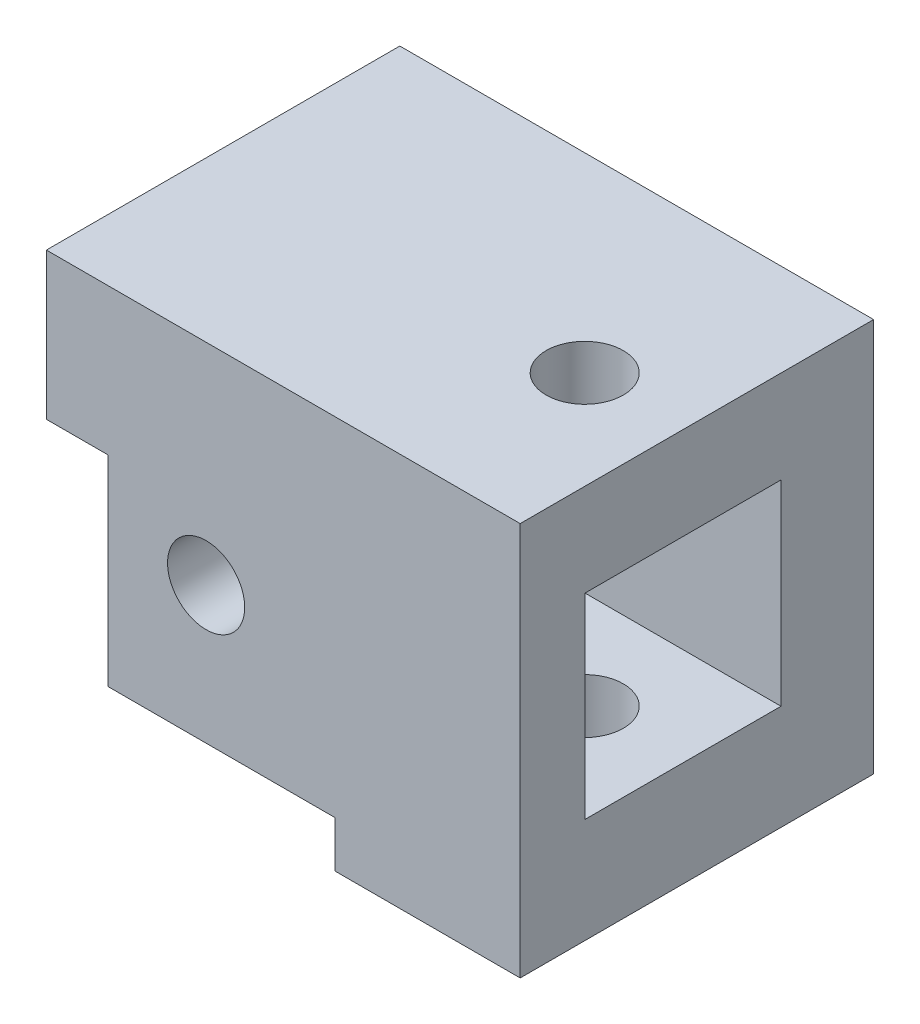
from build123d import *

# Parameters (mm, degrees)
SKETCH1_W               = 16.9
SKETCH1_H               = 24
BOSS_EXTRUDE1_DEPTH     = 17
SKETCH2_W               = 12.7
SKETCH2_H               = 12.7
CUT_EXTRUDE1_DEPTH      = 23.458906919
SKETCH3_R               = 2.5
CUT_EXTRUDE2_DEPTH      = 31.600694437
BOSS_EXTRUDE2_DEPTH     = 12.7
EXTRUDE_3_DEPTH         = 4
EXTRUDE_4_DEPTH         = 4
SKETCH5_R               = 2.5
CUT_EXTRUDE3_DEPTH      = 30.49254143
SKETCH_4_W              = 3
SKETCH_4_H              = 16.9
CUT_EXTRUDE_1_DEPTH     = 32.937477984
SKETCH_5_W              = 12.7
SKETCH_5_H              = 1.5
CUT_EXTRUDE_2_DEPTH     = 30.320641194
CUT_EXTRUDE4_DEPTH      = 25.039394751
CUT_EXTRUDE4_DEPTH_BACK = 2
SKETCH_6_W              = 4
SKETCH_6_H              = 24
CUT_EXTRUDE_3_DEPTH     = 25.039394751
SKETCH_7_W              = 20.9
SKETCH_7_H              = 1.5
CUT_EXTRUDE_4_DEPTH     = 26.469442475
SKETCH_8_W              = 4
SKETCH_8_H              = 22.5
CUT_EXTRUDE_5_DEPTH     = 36.234819426
SKETCH_9_W              = 4
SKETCH_9_H              = 17
CUT_EXTRUDE_6_DEPTH     = 27.617663308
SKETCH_11_W             = 12.7
SKETCH_11_H             = 3.8
EXTRUDE_5_DEPTH         = 2
SKETCH_12_W             = 6
SKETCH_12_H             = 22.5
EXTRUDE_6_DEPTH         = 26.7
SKETCH_21_W             = 22.9
SKETCH_21_H             = 9.5
EXTRUDE_7_DEPTH         = 4
SKETCH_14_R             = 2.5
CUT_EXTRUDE_7_DEPTH     = 31.778239066
SKETCH_22_W             = 12
SKETCH_22_H             = 22.9
SKETCH_22_R             = 2.5
EXTRUDE_8_DEPTH         = 3


with BuildPart() as part:
    # Sketch1 → Boss-Extrude1 (new body)
    with BuildSketch(Plane(origin=(0, 0, 0), x_dir=(0, 0, -1), z_dir=(1, 0, 0))):
        Rectangle(SKETCH1_W, SKETCH1_H)
    extrude(amount=BOSS_EXTRUDE1_DEPTH)

    # Sketch2 → Cut-Extrude1 (cut, through all)
    with BuildSketch(Plane(origin=(17, 0, 0), x_dir=(0, 0, -1), z_dir=(1, 0, 0))):
        with Locations((2.1, -0.35)):
            Rectangle(SKETCH2_W, SKETCH2_H)
    extrude(amount=-CUT_EXTRUDE1_DEPTH, mode=Mode.SUBTRACT)

    # Sketch3 → Cut-Extrude2 (cut, through all)
    with BuildSketch(Plane(origin=(0, 12, 0), x_dir=(1, 0, 0), z_dir=(0, 1, 0))):
        with Locations(Location((7.63, 2.1, 0), (0, 0, 270))):
            Circle(SKETCH3_R)
    extrude(amount=-CUT_EXTRUDE2_DEPTH, mode=Mode.SUBTRACT)

    # Sketch4 → Boss-Extrude2 (add)
    with BuildSketch(Plane.ZY):
        Polygon((-8.45, 12), (-8.45, 6), (4.25, 6), (4.25, -12), (8.45, -12), (8.45, 12), align=None)
    extrude(amount=BOSS_EXTRUDE2_DEPTH)

    # 草图3 → 凸台-拉伸3 (add)
    with BuildSketch(Plane.ZY.offset(12.7)):
        Polygon((8.45, 12), (-7.55, 12), (8.45, -5), align=None)
    extrude(amount=EXTRUDE_3_DEPTH)

    # 草图1 → 凸台-拉伸4 (add)
    with BuildSketch(Plane(origin=(0, 0, -8.45), x_dir=(-1, 0, 0), z_dir=(0, 0, -1))):
        Polygon((12.7, 12), (0, 12), (0, 0.5), (-11.445354581, -12), (1.274949719, -12), (12.7, -12), align=None)
    extrude(amount=EXTRUDE_4_DEPTH)

    # Sketch5 → Cut-Extrude3 (cut, through all)
    with BuildSketch(Plane.XY.offset(8.45)):
        with Locations((-6.35, -1.63)):
            Circle(SKETCH5_R)
    extrude(amount=-CUT_EXTRUDE3_DEPTH, mode=Mode.SUBTRACT)

    # 草图4 → 切除-拉伸1 (cut, through all)
    with BuildSketch(Plane(origin=(0, 12, 0), x_dir=(1, 0, 0), z_dir=(0, 1, 0))):
        with Locations((15.5, 0)):
            Rectangle(SKETCH_4_W, SKETCH_4_H)
    extrude(amount=-CUT_EXTRUDE_1_DEPTH, mode=Mode.SUBTRACT)

    # 草图5 → 切除-拉伸2 (cut, through all)
    with BuildSketch(Plane.XY.offset(8.45)):
        with Locations((-6.35, -11.25)):
            Rectangle(SKETCH_5_W, SKETCH_5_H)
    extrude(amount=-CUT_EXTRUDE_2_DEPTH, mode=Mode.SUBTRACT)

    # Sketch7 → Cut-Extrude4 (cut, two sides: drawn at the far end of the back side and taken through both)
    with BuildSketch(Plane.ZY.offset(-CUT_EXTRUDE4_DEPTH_BACK)):
        Polygon((4.25, -6.7), (-8.45, -6.7), (-8.45, -10.5), (-12.45, -10.5), (-12.45, -12), (8.45, -12), (8.45, -10.5), (4.25, -10.5), align=None)
    extrude(amount=CUT_EXTRUDE4_DEPTH + CUT_EXTRUDE4_DEPTH_BACK, mode=Mode.SUBTRACT)

    # 草图6 → 切除-拉伸3 (cut, through all)
    with BuildSketch(Plane(origin=(0, 0, 0), x_dir=(0, 0, -1), z_dir=(1, 0, 0))):
        with Locations((10.45, 0)):
            Rectangle(SKETCH_6_W, SKETCH_6_H)
    extrude(amount=-CUT_EXTRUDE_3_DEPTH, mode=Mode.SUBTRACT)

    # 草图7 → 切除-拉伸4 (cut, through all)
    with BuildSketch(Plane.ZY.offset(-2)):
        with Locations((-2, -11.25)):
            Rectangle(SKETCH_7_W, SKETCH_7_H)
    extrude(amount=-CUT_EXTRUDE_4_DEPTH, mode=Mode.SUBTRACT)

    # 草图8 → 切除-拉伸5 (cut, through all)
    with BuildSketch(Plane(origin=(14, 0, 0), x_dir=(0, 0, -1), z_dir=(1, 0, 0))):
        with Locations((10.45, 0.75)):
            Rectangle(SKETCH_8_W, SKETCH_8_H)
    extrude(amount=-CUT_EXTRUDE_5_DEPTH, mode=Mode.SUBTRACT)

    # 草图9 → 切除-拉伸6 (cut, through all)
    with BuildSketch(Plane(origin=(0, 0, -8.45), x_dir=(-1, 0, 0), z_dir=(0, 0, -1))):
        with Locations((14.7, 3.5)):
            Rectangle(SKETCH_9_W, SKETCH_9_H)
    extrude(amount=-CUT_EXTRUDE_6_DEPTH, mode=Mode.SUBTRACT)

    # 草图11 → 凸台-拉伸5 (add)
    with BuildSketch(Plane.ZY.offset(-2)):
        with Locations((-2.1, -8.6)):
            Rectangle(SKETCH_11_W, SKETCH_11_H)
    extrude(amount=EXTRUDE_5_DEPTH)

    # 草图12 → 凸台-拉伸6 (add)
    with BuildSketch(Plane(origin=(14, 0, 0), x_dir=(0, 0, -1), z_dir=(1, 0, 0))):
        with Locations((11.45, 0.75)):
            Rectangle(SKETCH_12_W, SKETCH_12_H)
    extrude(amount=-EXTRUDE_6_DEPTH)

    # 草图21 → 凸台-拉伸7 (add)
    with BuildSketch(Plane.ZY.offset(12.7)):
        with Locations((-3, 7.25)):
            Rectangle(SKETCH_21_W, SKETCH_21_H)
    extrude(amount=EXTRUDE_7_DEPTH)

    # 草图14 → 切除-拉伸7 (cut, through all)
    with BuildSketch(Plane.XY.offset(8.45)):
        with Locations((-6.35, -1.63)):
            Circle(SKETCH_14_R)
    extrude(amount=-CUT_EXTRUDE_7_DEPTH, mode=Mode.SUBTRACT)

    # 草图22 → 凸台-拉伸8 (add)
    with BuildSketch(Plane.XZ.offset(10.5)):
        with Locations((8, -3)):
            Rectangle(SKETCH_22_W, SKETCH_22_H)
        with Locations(Location((7.63, -2.1, 0), (0, 0, 90))):
            Circle(SKETCH_22_R, mode=Mode.SUBTRACT)
    extrude(amount=EXTRUDE_8_DEPTH)


solid = part.part
